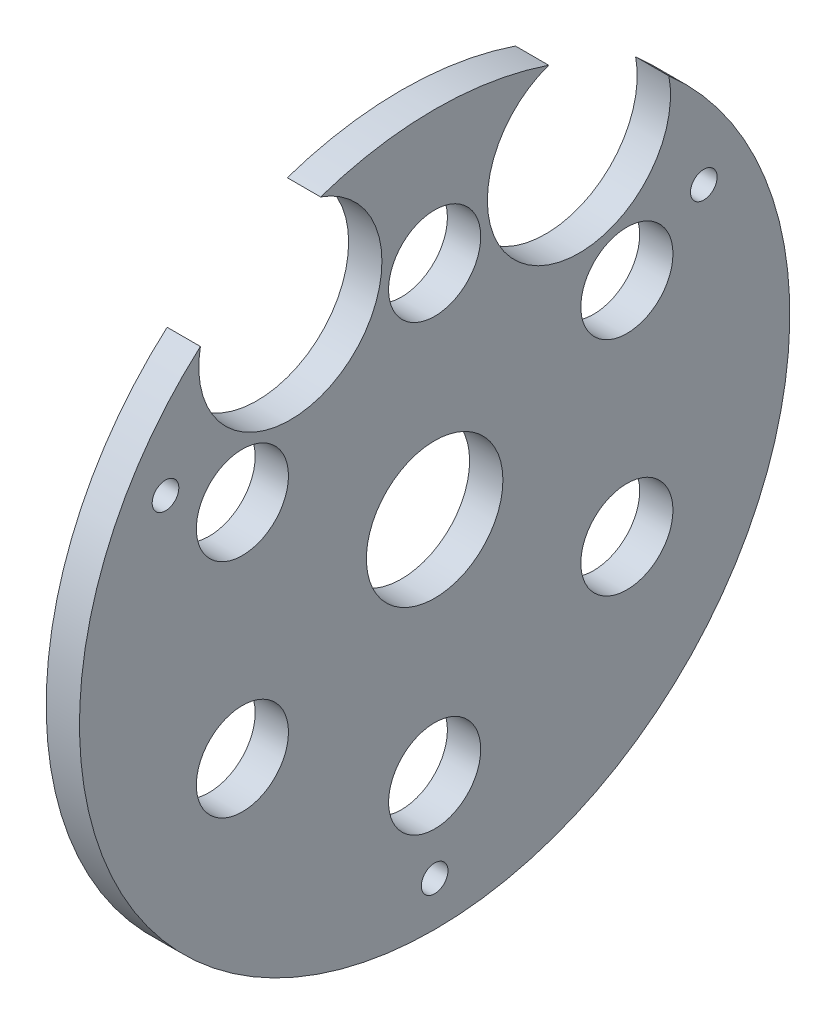
from build123d import *

# Parameters (mm, degrees)
AXIAL_BLANK_PROFILE_W                     = 3
AXIAL_BLANK_PROFILE_H                     = 32
MAGNET_BASE_START                         = -17
MAGNET_BASE_LOCATOR_BORES_SKETCH_R        = 6.15
MAGNET_BASE_LOCATOR_BORES_SKETCH_R_2      = 4.15
MAGNET_BASE_LOCATOR_BORES_DEPTH           = 3
OPEN_START                                = -17
OPEN_FITTING_ROUTE_RELIEFS_SKETCH_R       = 8.25
OPEN_FITTING_ROUTE_RELIEFS_DEPTH          = 3
THREE_START                               = -17
THREE_M2_LOCATOR_CLEARANCE_HOLES_SKETCH_R = 1.2
THREE_M2_LOCATOR_CLEARANCE_HOLES_DEPTH    = 3


with BuildPart() as part:
    # Axial blank profile → Native revolved blank (revolve)
    with BuildSketch(Plane.XY, mode=Mode.PRIVATE) as native_revolved_blank_sk:
        with Locations((-15.5, 16)):
            Rectangle(AXIAL_BLANK_PROFILE_W, AXIAL_BLANK_PROFILE_H)
    revolve(native_revolved_blank_sk.sketch.rotate(Axis((-60, 0, 0), (1, 0, 0)), 90), axis=Axis((-60, 0, 0), (1, 0, 0)))

    # Magnet-base locator bores sketch → Magnet-base locator bores (cut)
    with BuildSketch(Plane(origin=(0, 0, 0), x_dir=(0, 0, -1), z_dir=(1, 0, 0)).offset(MAGNET_BASE_START)):
        Circle(MAGNET_BASE_LOCATOR_BORES_SKETCH_R)
        with Locations((0, 20)):
            Circle(MAGNET_BASE_LOCATOR_BORES_SKETCH_R_2)
        with Locations((-17.320508076, 10)):
            Circle(MAGNET_BASE_LOCATOR_BORES_SKETCH_R_2)
        with Locations((-17.320508076, -10)):
            Circle(MAGNET_BASE_LOCATOR_BORES_SKETCH_R_2)
        with Locations((0, -20)):
            Circle(MAGNET_BASE_LOCATOR_BORES_SKETCH_R_2)
        with Locations((17.320508076, -10)):
            Circle(MAGNET_BASE_LOCATOR_BORES_SKETCH_R_2)
        with Locations((17.320508076, 10)):
            Circle(MAGNET_BASE_LOCATOR_BORES_SKETCH_R_2)
    extrude(amount=MAGNET_BASE_LOCATOR_BORES_DEPTH, mode=Mode.SUBTRACT)

    # Open fitting-route reliefs sketch → Open fitting-route reliefs (cut)
    with BuildSketch(Plane(origin=(0, 0, 0), x_dir=(0, 0, -1), z_dir=(1, 0, 0)).offset(OPEN_START)):
        with Locations((-13, 22.516660498)):
            Circle(OPEN_FITTING_ROUTE_RELIEFS_SKETCH_R)
        with Locations((13, 22.516660498)):
            Circle(OPEN_FITTING_ROUTE_RELIEFS_SKETCH_R)
    extrude(amount=OPEN_FITTING_ROUTE_RELIEFS_DEPTH, mode=Mode.SUBTRACT)

    # Three M2 locator clearance holes sketch → Three M2 locator clearance holes (cut)
    with BuildSketch(Plane(origin=(0, 0, 0), x_dir=(0, 0, -1), z_dir=(1, 0, 0)).offset(THREE_START)):
        with Locations((-24.248711306, 14)):
            Circle(THREE_M2_LOCATOR_CLEARANCE_HOLES_SKETCH_R)
        with Locations((0, -28)):
            Circle(THREE_M2_LOCATOR_CLEARANCE_HOLES_SKETCH_R)
        with Locations((24.248711306, 14)):
            Circle(THREE_M2_LOCATOR_CLEARANCE_HOLES_SKETCH_R)
    extrude(amount=THREE_M2_LOCATOR_CLEARANCE_HOLES_DEPTH, mode=Mode.SUBTRACT)


solid = part.part
